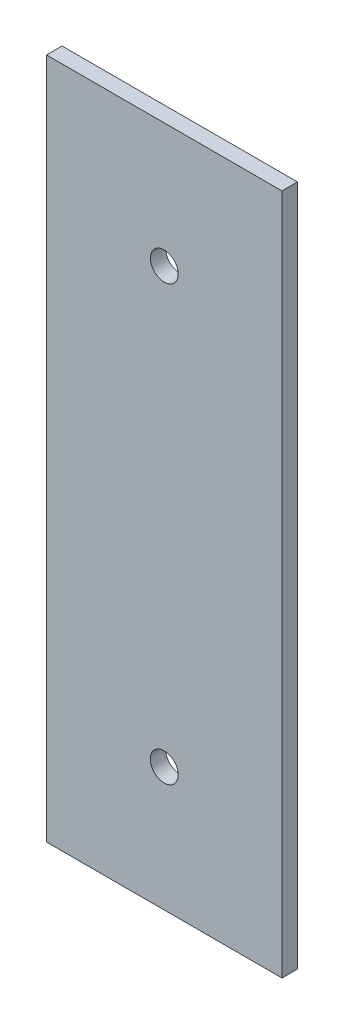
from build123d import *

# Parameters (mm, degrees)
SKETCH1_W               = 38
SKETCH1_H               = 110
BOSS_EXTRUDE1_DEPTH     = 2.5
CUT_EXTRUDE1_DEPTH      = 59.243025334
CUT_EXTRUDE1_DEPTH_BACK = 59.243025334
SKETCH2_R               = 2.25


with BuildPart() as part:
    # Sketch1 → Boss-Extrude1 (new body)
    with BuildSketch(Plane.XY):
        Rectangle(SKETCH1_W, SKETCH1_H)
    extrude(amount=BOSS_EXTRUDE1_DEPTH)

    # Sketch2 → Cut-Extrude1 (cut, two sides: drawn at the far end of the back side and taken through both)
    with BuildSketch(Plane.XY.offset(2.5).offset(-CUT_EXTRUDE1_DEPTH_BACK)):
        with Locations((0, 35)):
            Circle(SKETCH2_R)
        with Locations((0, -35)):
            Circle(SKETCH2_R)
    extrude(amount=CUT_EXTRUDE1_DEPTH + CUT_EXTRUDE1_DEPTH_BACK, mode=Mode.SUBTRACT)


solid = part.part
